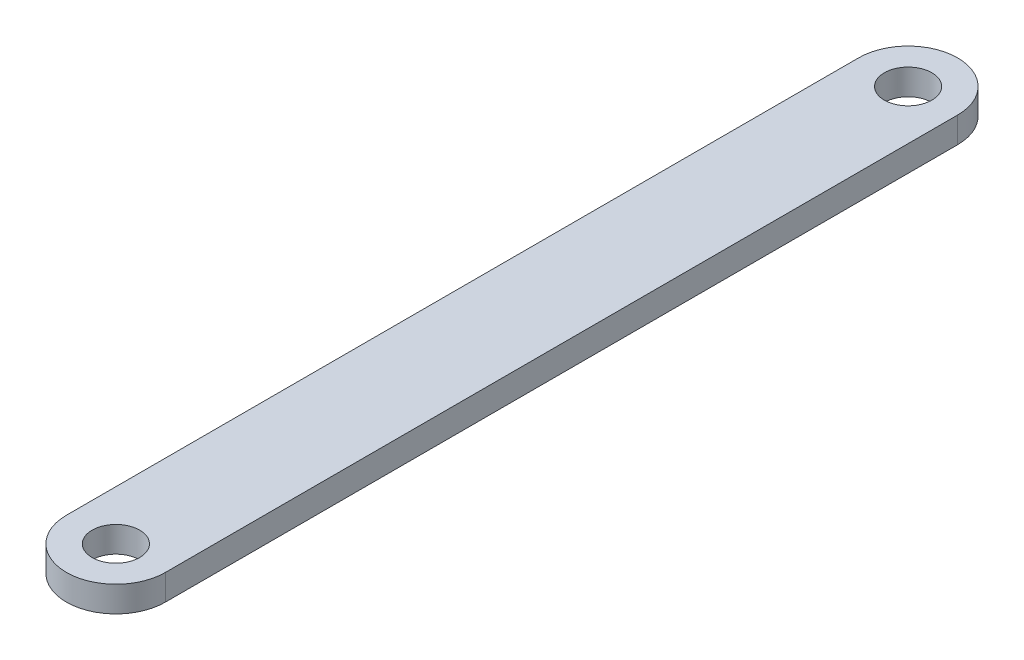
from build123d import *

# Parameters (mm, degrees)
SKETCH3_R           = 6
BOSS_EXTRUDE1_DEPTH = 3.25


with BuildPart() as part:
    # Sketch3 → Boss-Extrude1 (new, symmetric)
    with BuildSketch(Plane(origin=(0, 0, 0), x_dir=(1, 0, 0), z_dir=(0, 1, 0))):
        with BuildLine():
            Line((-12.5, 100), (-12.5, -100))
            ThreePointArc((-12.5, -100), (0, -112.5), (12.5, -100))
            Line((12.5, -100), (12.5, 100))
            ThreePointArc((12.5, 100), (0, 112.5), (-12.5, 100))
        make_face()
        with Locations(Location((0, 100, 0), (0, 0, 90))):
            Circle(SKETCH3_R, mode=Mode.SUBTRACT)
        with Locations(Location((0, -100, 0), (0, 0, 90))):
            Circle(SKETCH3_R, mode=Mode.SUBTRACT)
    extrude(amount=BOSS_EXTRUDE1_DEPTH, both=True)


solid = part.part
